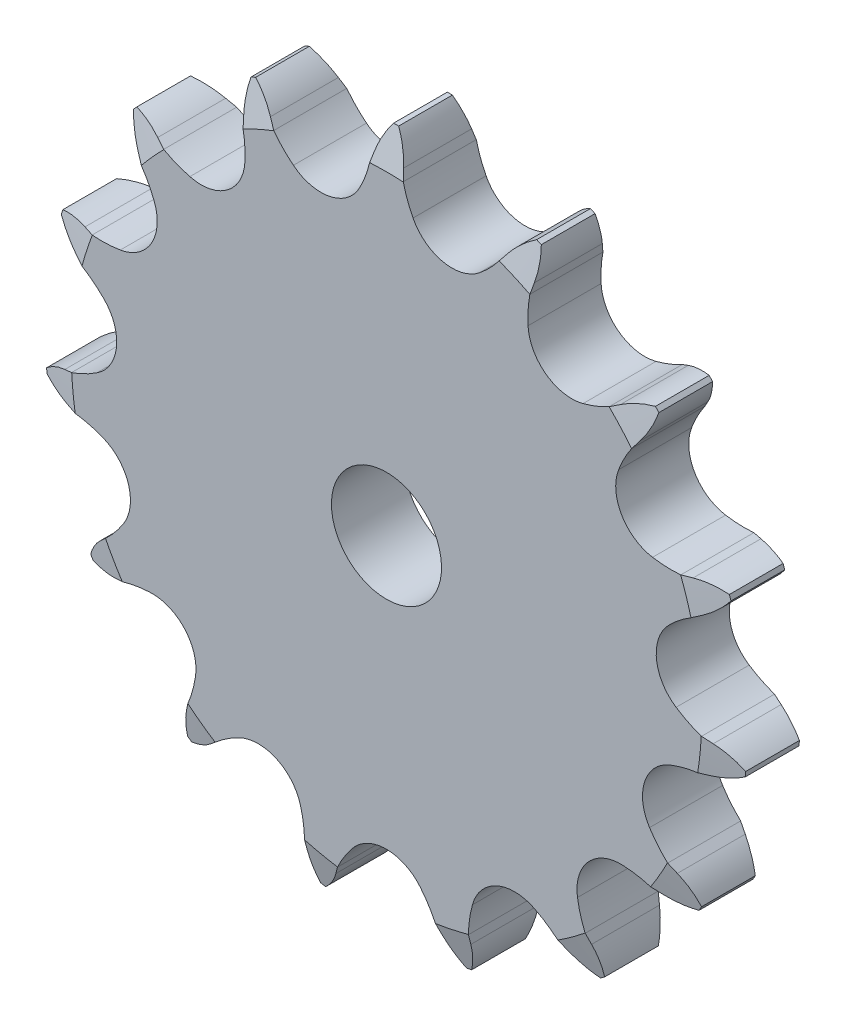
from build123d import *

# Parameters (mm, degrees)
SKETCH3_W          = 5.31
SKETCH3_H          = 21.527
CUT_EXTRUDE4_DEPTH = 37.19812817
CIRPATTERN2_COUNT  = 15
SKETCH5_OUTSIDE_W  = 346.374
SKETCH5_OUTSIDE_H  = 346.096
SKETCH5_OUTSIDE_R  = 22.906359817
CUT_EXTRUDE5_DEPTH = 37.404331097
CUT_EXTRUDE5_DRAFT = -75
SKETCH6_OUTSIDE_W  = 346.374
SKETCH6_OUTSIDE_H  = 346.096
SKETCH6_OUTSIDE_R  = 22.906359817
CUT_EXTRUDE6_DEPTH = 37.404331252
CUT_EXTRUDE6_DRAFT = -75


with BuildPart() as part:
    # Sketch3 → Revolve5 (revolve)
    with BuildSketch(Plane(origin=(0, 0, 0), x_dir=(0, 0, -1), z_dir=(1, 0, 0)), mode=Mode.PRIVATE) as revolve5_sk:
        with Locations((0, 14.7635)):
            Rectangle(SKETCH3_W, SKETCH3_H)
    revolve(revolve5_sk.sketch.rotate(Axis((0, 0, 2.655), (0, 0, -1)), 180), axis=Axis((0, 0, 2.655), (0, 0, -1)))

    # Sketch4 → Cut-Extrude4 (cut, symmetric)
    with BuildSketch(Plane.XY):
        with BuildLine():
            Line((1.219884983, 22.88872777), (1.063923116, 23.578912677))
            ThreePointArc((1.063923116, 23.578912677), (0.65856297, 24.734033373), (0, 25.765980797))
            ThreePointArc((0, 25.765980797), (5.974327611, 28.107001564), (10.479968535, 23.538394719))
            ThreePointArc((10.479968535, 23.538394719), (9.458610494, 22.863525529), (8.61846566, 21.973145089))
            Line((8.61846566, 21.973145089), (8.195263912, 21.406065208))
            ThreePointArc((8.195263912, 21.406065208), (7.524676999, 20.626400483), (6.762535268, 19.935963031))
            ThreePointArc((6.762535268, 19.935963031), (4.101738454, 19.297162233), (1.930803303, 20.962979364))
            ThreePointArc((1.930803303, 20.962979364), (1.515378398, 21.903716331), (1.219884983, 22.88872777))
        make_face()
    cut_extrude4 = extrude(amount=CUT_EXTRUDE4_DEPTH, both=True, mode=Mode.SUBTRACT)

    # CirPattern2: Cut-Extrude4 ×15 about axis
    cirpattern2_axis = Axis((0, 0, 0), (0, 0, 1))
    for i in range(1, CIRPATTERN2_COUNT):
        add(cut_extrude4.rotate(cirpattern2_axis, i * 360 / CIRPATTERN2_COUNT), mode=Mode.SUBTRACT)


with BuildPart() as cut_extrude5_tool:
    # Sketch5 outside → Cut-Extrude5 (with draft: the straight prism first)
    with BuildSketch(Plane.XY.offset(2.655)):
        with Locations((0, 0.26)):
            Rectangle(SKETCH5_OUTSIDE_W, SKETCH5_OUTSIDE_H)
        Circle(SKETCH5_OUTSIDE_R, mode=Mode.SUBTRACT)
    extrude(amount=-CUT_EXTRUDE5_DEPTH)
    # Cut-Extrude5: the draft: its side faces are tilted about the plane it starts from
    cut_extrude5_sides = [cut_extrude5_tool.faces().sort_by_distance(p)[0] for p in [
        (0, -172.788, -16.047165549),
        (173.187, 0.26, -16.047165549),
        (0, 173.308, -16.047165549),
        (-173.187, 0.26, -16.047165549),
        (-22.906359817, 0, -16.047165549),
    ]]
    draft(cut_extrude5_sides, Plane.XY.offset(2.655), CUT_EXTRUDE5_DRAFT)


with BuildPart() as part_1:
    add(part.part)

    # Cut-Extrude5: cut by cut_extrude5_tool
    add(cut_extrude5_tool.part, mode=Mode.SUBTRACT)


with BuildPart() as cut_extrude6_tool:
    # Sketch6 outside → Cut-Extrude6 (with draft: the straight prism first)
    with BuildSketch(Plane(origin=(0, 0, -2.655), x_dir=(-1, 0, 0), z_dir=(0, 0, -1))):
        with Locations((0, 0.26)):
            Rectangle(SKETCH6_OUTSIDE_W, SKETCH6_OUTSIDE_H)
        Circle(SKETCH6_OUTSIDE_R, mode=Mode.SUBTRACT)
    extrude(amount=-CUT_EXTRUDE6_DEPTH)
    # Cut-Extrude6: the draft: its side faces are tilted about the plane it starts from
    cut_extrude6_sides = [cut_extrude6_tool.faces().sort_by_distance(p)[0] for p in [
        (0, -172.788, 16.047165626),
        (-173.187, 0.26, 16.047165626),
        (0, 173.308, 16.047165626),
        (173.187, 0.26, 16.047165626),
        (22.906359817, 0, 16.047165626),
    ]]
    draft(cut_extrude6_sides, Plane(origin=(0, 0, -2.655), x_dir=(-1, 0, 0), z_dir=(0, 0, -1)), CUT_EXTRUDE6_DRAFT)


with BuildPart() as part_2:
    add(part_1.part)

    # Cut-Extrude6: cut by cut_extrude6_tool
    add(cut_extrude6_tool.part, mode=Mode.SUBTRACT)


solid = part_2.part
